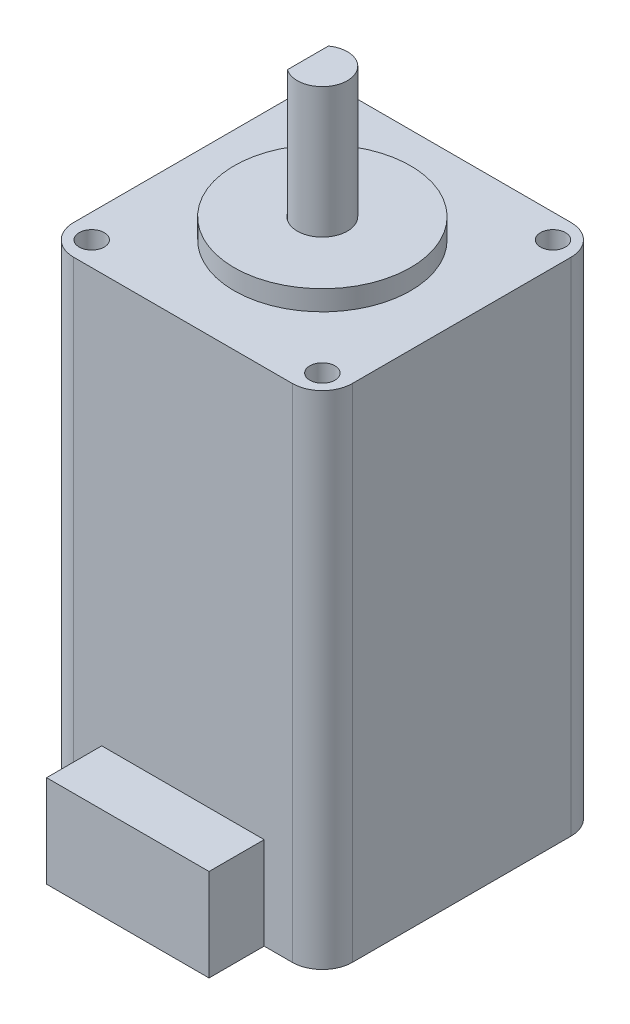
from build123d import *

# Parameters (mm, degrees)
SKETCH_1_W          = 27.8
SKETCH_1_H          = 27.8
EXTRUDE_1_DEPTH     = 50
SKETCH_2_R          = 8.8
EXTRUDE_2_DEPTH     = 2
SKETCH_3_R          = 2.5
EXTRUDE_3_DEPTH     = 13
SKETCH_5_W          = 16.2
SKETCH_5_H          = 9.2
EXTRUDE_4_DEPTH     = 5.5
SKETCH_6_R          = 1.25
CUT_EXTRUDE_1_DEPTH = 5
FILLET_1_R          = 3
SKETCH_7_R          = 4
CUT_EXTRUDE_2_DEPTH = 5
CUT_EXTRUDE_START   = -20
CUT_EXTRUDE_3_DEPTH = 20


with BuildPart() as part:
    # 草图1 → 凸台-拉伸1 (new body)
    with BuildSketch(Plane(origin=(0, 0, 0), x_dir=(1, 0, 0), z_dir=(0, 1, 0))):
        Rectangle(SKETCH_1_W, SKETCH_1_H)
    extrude(amount=EXTRUDE_1_DEPTH)

    # 草图2 → 凸台-拉伸2 (add)
    with BuildSketch(Plane(origin=(0, 50, 0), x_dir=(1, 0, 0), z_dir=(0, 1, 0))):
        with Locations(Location((0, 0, 0), (0, 0, 270))):
            Circle(SKETCH_2_R)
    extrude(amount=EXTRUDE_2_DEPTH)

    # 草图3 → 凸台-拉伸3 (add)
    with BuildSketch(Plane(origin=(0, 52, 0), x_dir=(1, 0, 0), z_dir=(0, 1, 0))):
        with Locations(Location((0, 0, 0), (0, 0, 90))):
            Circle(SKETCH_3_R)
    extrude(amount=EXTRUDE_3_DEPTH)

    # 草图5 → 凸台-拉伸4 (add)
    with BuildSketch(Plane.XY.offset(13.9)):
        with Locations((0, 4.6)):
            Rectangle(SKETCH_5_W, SKETCH_5_H)
    extrude(amount=EXTRUDE_4_DEPTH)

    # 草图6 → 切除-拉伸1 (cut)
    with BuildSketch(Plane(origin=(0, 50, 0), x_dir=(1, 0, 0), z_dir=(0, 1, 0))):
        with Locations(Location((-11.5, 11.5, 0), (0, 0, 270))):
            Circle(SKETCH_6_R)
        with Locations(Location((11.5, 11.5, 0), (0, 0, 270))):
            Circle(SKETCH_6_R)
        with Locations(Location((11.5, -11.5, 0), (0, 0, 270))):
            Circle(SKETCH_6_R)
        with Locations(Location((-11.5, -11.5, 0), (0, 0, 270))):
            Circle(SKETCH_6_R)
    extrude(amount=-CUT_EXTRUDE_1_DEPTH, mode=Mode.SUBTRACT)

    # 圆角1
    fillet_1_edges = [part.edges().sort_by_distance(p)[0] for p in [
        (13.9, 25, 13.9),
        (-13.9, 25, 13.9),
        (-13.9, 25, -13.9),
        (13.9, 25, -13.9),
    ]]
    fillet(fillet_1_edges, radius=FILLET_1_R)

    # 草图7 → 切除-拉伸2 (cut)
    with BuildSketch(Plane.XZ):
        with Locations(Location((0, 0, 0), (0, 0, 270))):
            Circle(SKETCH_7_R)
    extrude(amount=-CUT_EXTRUDE_2_DEPTH, mode=Mode.SUBTRACT)

    # 草图8 → 切除-拉伸3 (cut)
    with BuildSketch(Plane(origin=(0, 65, 0), x_dir=(1, 0, 0), z_dir=(0, 1, 0)).offset(CUT_EXTRUDE_START)):
        with BuildLine():
            Line((-1.438247, -2.044858324), (-1.438247, 2.044858324))
            ThreePointArc((-1.438247, 2.044858324), (-2.5, 0), (-1.438247, -2.044858324))
        make_face()
    extrude(amount=CUT_EXTRUDE_3_DEPTH, mode=Mode.SUBTRACT)


solid = part.part
